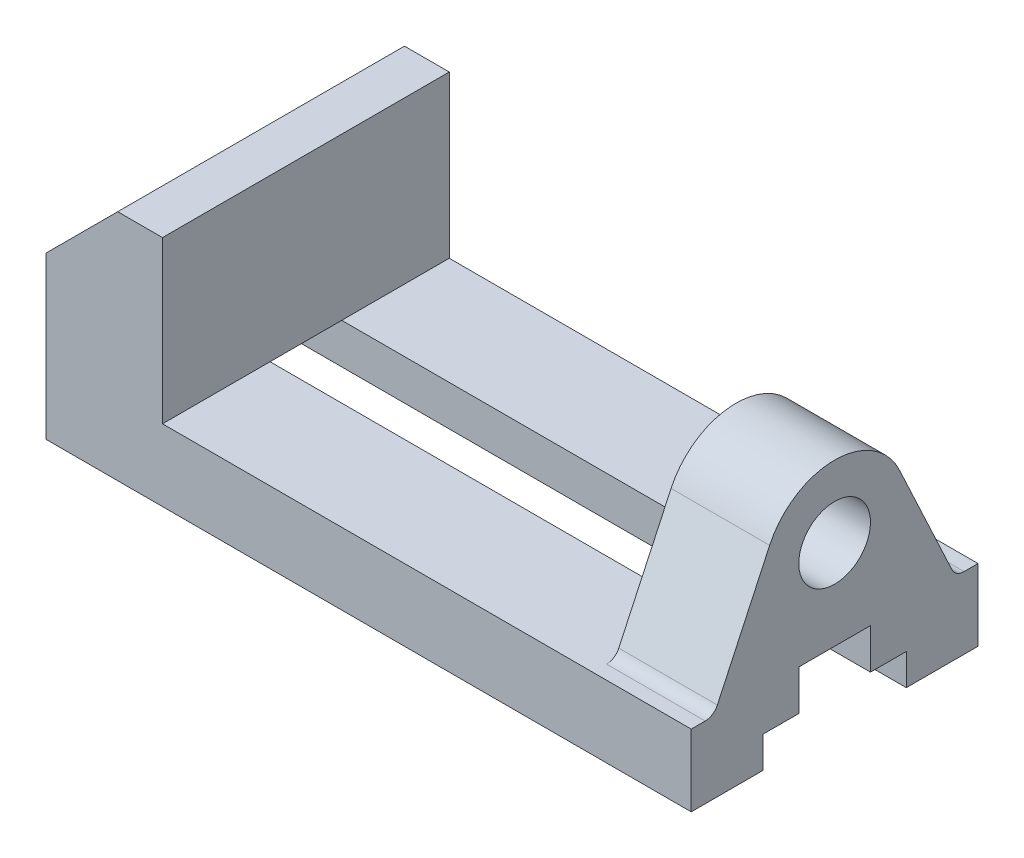
from build123d import *

# Parameters (mm, degrees)
SKETCH1_W                 = 144
SKETCH1_H                 = 52
BOSS_EXTRUDE1_DEPTH       = 32
SKETCH2_W                 = 96
SKETCH2_H                 = 50.918867004
CUT_EXTRUDE1_DEPTH        = 64
CHAMFER1_SIZE             = 16
SKETCH3_R                 = 8
CUT_EXTRUDE7_DEPTH        = 22
CUT_EXTRUDE8_DEPTH        = 150.786514747
F_6_0MM_DOWEL_HOLE1_D     = 6
F_6_0MM_DOWEL_HOLE1_DEPTH = 10
F_6_0MM_DOWEL_HOLE1_TIP   = 1.802581857


with BuildPart() as part:
    # Sketch1 → Boss-Extrude1 (new, symmetric)
    with BuildSketch(Plane.XY):
        Rectangle(SKETCH1_W, SKETCH1_H)
    extrude(amount=BOSS_EXTRUDE1_DEPTH, both=True)

    # Sketch2 → Cut-Extrude1 (cut)
    with BuildSketch(Plane.XY.offset(32)):
        with Locations((2, 15.459433502)):
            Rectangle(SKETCH2_W, SKETCH2_H)
    extrude(amount=-CUT_EXTRUDE1_DEPTH, mode=Mode.SUBTRACT)

    # Chamfer1
    chamfer1_edges = [part.edges().sort_by_distance(p)[0] for p in [
        (-72, 26, 0),
    ]]
    chamfer(chamfer1_edges, length=CHAMFER1_SIZE)

    # Sketch3 → Cut-Extrude7 (cut)
    with BuildSketch(Plane(origin=(72, 0, 0), x_dir=(0, 0, -1), z_dir=(1, 0, 0))):
        with BuildLine():
            ThreePointArc((26.172487288, -8.267854785), (27.279511824, -9.530174337), (28.891410649, -10))
            Line((28.891410649, -10), (32, -10))
            Line((32, -10), (32, 26))
            Line((32, 26), (-5.5e-08, 26))
            ThreePointArc((-5.5e-08, 26), (8.596793711, 23.494263148), (14.500924593, 16.761892188))
            Line((14.500924593, 16.761892188), (26.172487288, -8.267854785))
        make_face()
        with BuildLine():
            ThreePointArc((-14.500924593, 16.761892188), (-8.596793757, 23.494263118), (-5.5e-08, 26))
            Line((-5.5e-08, 26), (-32, 26))
            Line((-32, 26), (-32, -10))
            Line((-32, -10), (-28.891410649, -10))
            ThreePointArc((-28.891410649, -10), (-27.279511824, -9.530174337), (-26.172487288, -8.267854785))
            Line((-26.172487288, -8.267854785), (-14.500924593, 16.761892188))
        make_face()
        with Locations(Location((0, 10, 0), (0, 0, 90))):
            Circle(SKETCH3_R)
    extrude(amount=-CUT_EXTRUDE7_DEPTH, mode=Mode.SUBTRACT)

    # Sketch6 → Cut-Extrude8 (cut, through all)
    with BuildSketch(Plane(origin=(72, 0, 0), x_dir=(0, 0, -1), z_dir=(1, 0, 0))):
        Polygon((8, -19), (16, -19), (16, -26), (-16, -26), (-16, -19), (-8, -19), (-8, -10), (8, -10), align=None)
    extrude(amount=-CUT_EXTRUDE8_DEPTH, mode=Mode.SUBTRACT)

    # Ø6.0mm Dowel Hole1
    with Locations(Plane(origin=(-36, -26, 22), x_dir=(0, 0, -1), z_dir=(0, -1, 0))):
        with Locations((0, 0), (0, 70), (44, 70), (44, 0)):
            Hole(F_6_0MM_DOWEL_HOLE1_D / 2, depth=F_6_0MM_DOWEL_HOLE1_DEPTH)
            with Locations((0, 0, -(F_6_0MM_DOWEL_HOLE1_DEPTH + F_6_0MM_DOWEL_HOLE1_TIP / 2))):  # 118° drill point
                Cone(0, F_6_0MM_DOWEL_HOLE1_D / 2, F_6_0MM_DOWEL_HOLE1_TIP, mode=Mode.SUBTRACT)


solid = part.part
